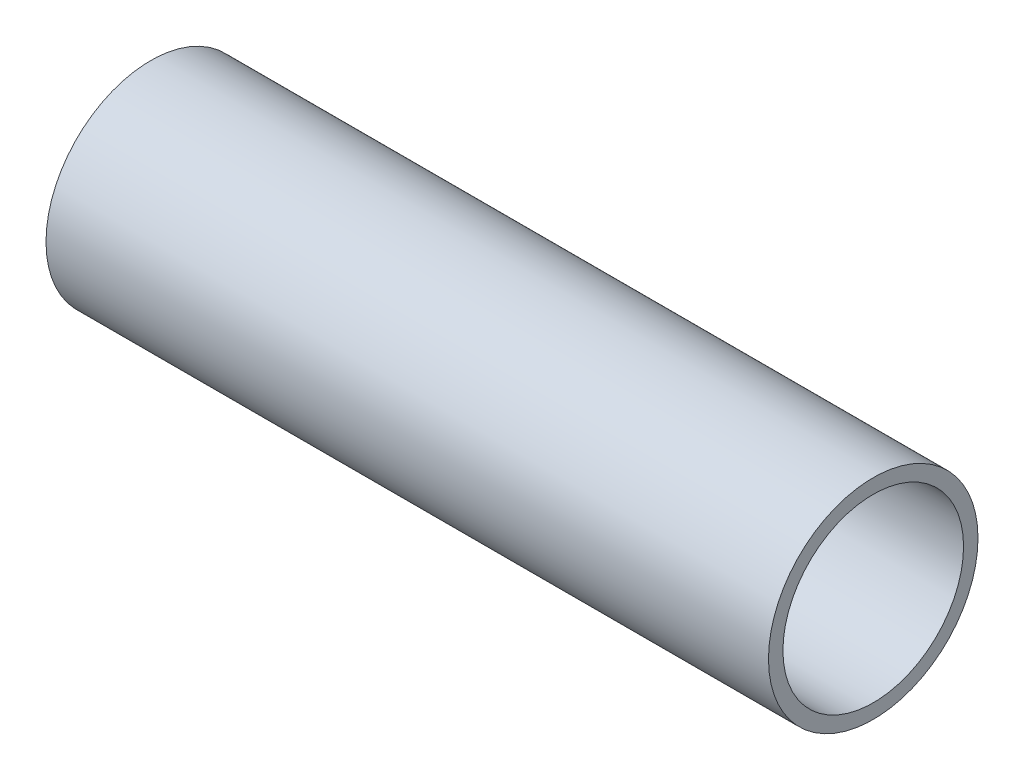
from build123d import *

# Parameters (mm, degrees)
SKETCH1_W = 100
SKETCH1_H = 2


with BuildPart() as part:
    # Sketch1 → Revolve1 (revolve)
    with BuildSketch(Plane.XY, mode=Mode.PRIVATE) as revolve1_sk:
        with Locations((0, 13.5)):
            Rectangle(SKETCH1_W, SKETCH1_H)
    revolve(revolve1_sk.sketch.rotate(Axis((0, 0, 0), (-1, 0, 0)), 90), axis=Axis((0, 0, 0), (-1, 0, 0)))


solid = part.part
